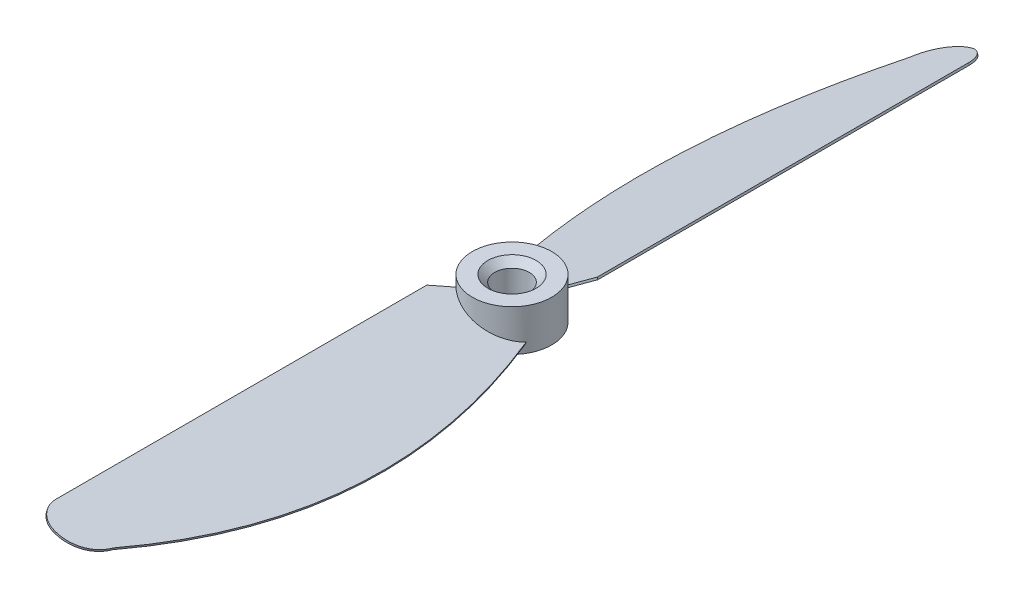
from build123d import *

# Parameters (mm, degrees)
SKETCH1_R           = 5.75
BOSS_EXTRUDE1_DEPTH = 3
BOSS_EXTRUDE2_DEPTH = 0.15
CIRPATTERN1_COUNT   = 2
SKETCH4_R           = 2.5
CUT_EXTRUDE1_DEPTH  = 65.47946021
CHAMFER1_SIZE       = 1


with BuildPart() as part:
    # Sketch1 → Boss-Extrude1 (new, symmetric)
    with BuildSketch(Plane(origin=(0, 0, 0), x_dir=(1, 0, 0), z_dir=(0, 1, 0))):
        with Locations(Location((0, 0, 0), (0, 0, 270))):
            Circle(SKETCH1_R)
    extrude(amount=BOSS_EXTRUDE1_DEPTH, both=True)

    # Sketch3 → Boss-Extrude2 (add, symmetric)
    with BuildSketch(Plane(origin=(0, 0, 0), x_dir=(0.9433030867471315, -0.3319326536111411, 0), z_dir=(-0.3319326536111411, -0.9433030867471315, 0))):
        with BuildLine():
            Line((-3.485399679, 3.239580817), (-6.069792392, 6.68067591))
            Line((-6.069792392, 6.68067591), (-6.069792392, 60.5))
            ThreePointArc((-6.069792392, 60.5), (-5.191112735, 62.621320344), (-3.069792392, 63.5))
            Line((-3.069792392, 63.5), (-2.854583135, 63.5))
            ThreePointArc((-2.854583135, 63.5), (0.220398514, 62.442649853), (1.994847243, 59.717795145))
            add(Edge.make_bspline(
                [(1.994847243, 59.717795145), (15.859721153, 31.612778986), (4.812953003, 1.848788557)],
                knots=[0, 0, 0, 1, 1, 1], degree=2))
            add(Edge.make_bspline(
                [(-3.485399679, 3.239580817), (0.91627292, 7.753975077), (4.812953003, 1.848788557)],
                knots=[0, 0, 0, 1, 1, 1], degree=2))
        make_face()
    boss_extrude2 = extrude(amount=BOSS_EXTRUDE2_DEPTH, both=True)

    # CirPattern1: Boss-Extrude2 ×2 about axis
    cirpattern1_axis = Axis((0, 3, 0), (0, -1, 0))
    for i in range(1, CIRPATTERN1_COUNT):
        add(boss_extrude2.rotate(cirpattern1_axis, i * 360 / CIRPATTERN1_COUNT))

    # Sketch4 → Cut-Extrude1 (cut, through all)
    with BuildSketch(Plane(origin=(0, 3, 0), x_dir=(1, 0, 0), z_dir=(0, 1, 0))):
        with Locations(Location((0, 0, 0), (0, 0, 270))):
            Circle(SKETCH4_R)
    extrude(amount=-CUT_EXTRUDE1_DEPTH, mode=Mode.SUBTRACT)

    # Chamfer1
    chamfer1_edges = [part.edges().sort_by_distance(p)[0] for p in [
        (0, -3, -2.5),
        (0, 3, -2.5),
    ]]
    chamfer(chamfer1_edges, length=CHAMFER1_SIZE)


solid = part.part
